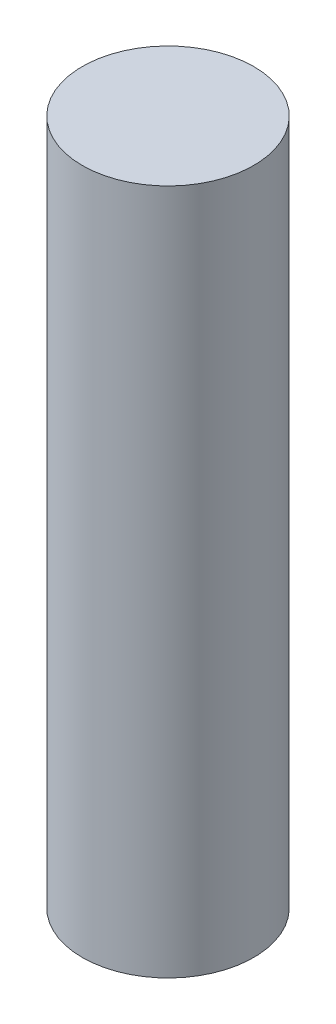
from build123d import *

# Parameters (mm, degrees)
BOSS_EXTRUDE1_DEPTH      = 38.1
BOSS_EXTRUDE1_DEPTH_BACK = 38.1
SKETCH1_R                = 9.525


with BuildPart() as part:
    # Sketch1 → Boss-Extrude1 (new, two sides: drawn at the far end of the back side and taken through both)
    with BuildSketch(Plane(origin=(0, 76.2, 0), x_dir=(1, 0, 0), z_dir=(0, 1, 0)).offset(-BOSS_EXTRUDE1_DEPTH_BACK)):
        with Locations((44.45, -44.45)):
            Circle(SKETCH1_R)
    extrude(amount=BOSS_EXTRUDE1_DEPTH + BOSS_EXTRUDE1_DEPTH_BACK)


solid = part.part
